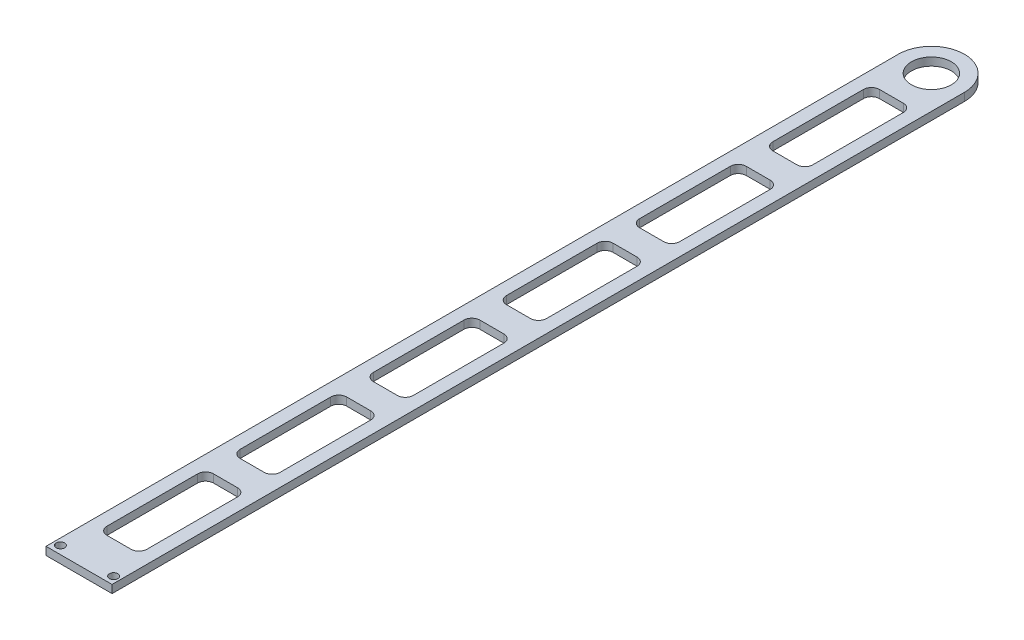
from build123d import *

# Parameters (mm, degrees)
SKETCH_1_R      = 7.5
SKETCH_1_R_2    = 1.6
SKETCH_1_W      = 15
SKETCH_1_H      = 40
EXTRUDE_1_DEPTH = 3
FILLET_1_R      = 3


with BuildPart() as part:
    # 草图1 → 凸台-拉伸1 (new body)
    with BuildSketch(Plane(origin=(0, 0, 0), x_dir=(1, 0, 0), z_dir=(0, 1, 0))):
        with BuildLine():
            Line((-12.4, 320), (-12.4, 0))
            Line((-12.4, 0), (12.4, 0))
            Line((12.4, 0), (12.4, 320))
            ThreePointArc((12.4, 320), (0, 332.4), (-12.4, 320))
        make_face()
        with Locations(Location((0, 320, 0), (0, 0, 270))):
            Circle(SKETCH_1_R, mode=Mode.SUBTRACT)
        with Locations(Location((10, 3, 0), (0, 0, 270))):
            Circle(SKETCH_1_R_2, mode=Mode.SUBTRACT)
        with Locations(Location((-10, 3, 0), (0, 0, 90))):
            Circle(SKETCH_1_R_2, mode=Mode.SUBTRACT)
        with Locations((0, 235)):
            Rectangle(SKETCH_1_W, SKETCH_1_H, mode=Mode.SUBTRACT)
        with Locations((0, 285)):
            Rectangle(SKETCH_1_W, SKETCH_1_H, mode=Mode.SUBTRACT)
        with Locations((0, 185)):
            Rectangle(SKETCH_1_W, SKETCH_1_H, mode=Mode.SUBTRACT)
        with Locations((0, 135)):
            Rectangle(SKETCH_1_W, SKETCH_1_H, mode=Mode.SUBTRACT)
        with Locations((0, 85)):
            Rectangle(SKETCH_1_W, SKETCH_1_H, mode=Mode.SUBTRACT)
        with Locations((0, 35)):
            Rectangle(SKETCH_1_W, SKETCH_1_H, mode=Mode.SUBTRACT)
    extrude(amount=EXTRUDE_1_DEPTH)

    # 圆角1
    fillet_1_edges = [part.edges().sort_by_distance(p)[0] for p in [
        (7.5, 1.5, -265),
        (7.5, 1.5, -305),
        (-7.5, 1.5, -305),
        (-7.5, 1.5, -265),
        (-7.5, 1.5, -215),
        (7.5, 1.5, -215),
        (7.5, 1.5, -255),
        (-7.5, 1.5, -255),
        (-7.5, 1.5, -165),
        (7.5, 1.5, -165),
        (7.5, 1.5, -205),
        (-7.5, 1.5, -205),
        (-7.5, 1.5, -115),
        (7.5, 1.5, -115),
        (7.5, 1.5, -155),
        (-7.5, 1.5, -155),
        (-7.5, 1.5, -65),
        (7.5, 1.5, -65),
        (7.5, 1.5, -105),
        (-7.5, 1.5, -105),
        (-7.5, 1.5, -15),
        (7.5, 1.5, -15),
        (7.5, 1.5, -55),
        (-7.5, 1.5, -55),
    ]]
    fillet(fillet_1_edges, radius=FILLET_1_R)


solid = part.part
